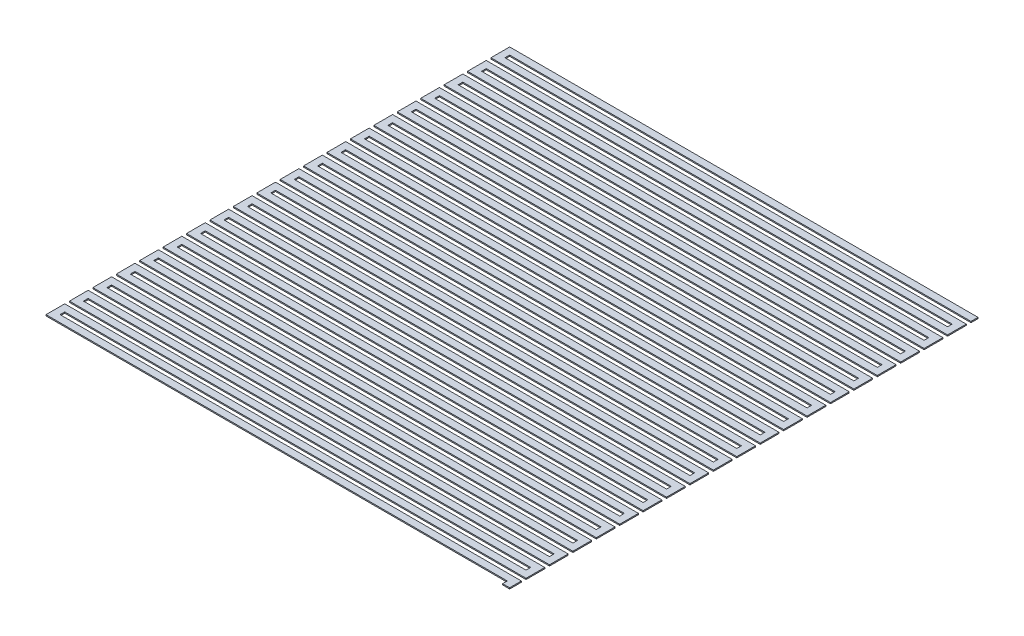
from build123d import *

# Parameters (mm, degrees)
EXTRUDED_OBJECT_DEPTH = 0.05
BOSS_EXTRUDE2_DEPTH   = 0.05
LPATTERN1_COUNT       = 19
LPATTERN1_PITCH       = 1
SKETCH1_W             = 0.3
SKETCH1_H             = 0.2
BOSS_EXTRUDE3_DEPTH   = 0.05


with BuildPart() as part:
    # TopBlock → Extruded object (new body)
    with BuildSketch(Plane(origin=(0, 0, 0), x_dir=(1, 0, 0), z_dir=(0, 1, 0))):
        Polygon((-10, 10), (-9.7, 10), (10, 10), (10, 9.7), (-9.7, 9.7), (-9.7, 9.5), (9.7, 9.5), (10, 9.5), (10, 9.2), (9.7, 9.2), (-9.7, 9.2), (-10, 9.2), (-10, 9.5), (-10, 9.7), align=None)
    extrude(amount=EXTRUDED_OBJECT_DEPTH)

    # GapandInbetween → Boss-Extrude2 (add)
    with BuildSketch(Plane(origin=(0, 0, 0), x_dir=(1, 0, 0), z_dir=(0, 1, 0))):
        Polygon((10, 9.2), (10, 9), (10, 8.7), (-9.7, 8.7), (-9.7, 8.5), (10, 8.5), (10, 8.2), (9.7, 8.2), (-10, 8.2), (-10, 8.5), (-10, 8.7), (-10, 9), (9.7, 9), (9.7, 9.2), align=None)
    boss_extrude2 = extrude(amount=BOSS_EXTRUDE2_DEPTH)

    # LPattern1: Boss-Extrude2 ×19
    with Locations(*[(0, 0, i * LPATTERN1_PITCH) for i in range(1, LPATTERN1_COUNT)]):
        add(boss_extrude2)

    # Sketch1 → Boss-Extrude3 (add)
    with BuildSketch(Plane(origin=(0, 0, 0), x_dir=(1, 0, 0), z_dir=(0, 1, 0))):
        with Locations((9.85, -9.9)):
            Rectangle(SKETCH1_W, SKETCH1_H)
    extrude(amount=BOSS_EXTRUDE3_DEPTH)


solid = part.part
